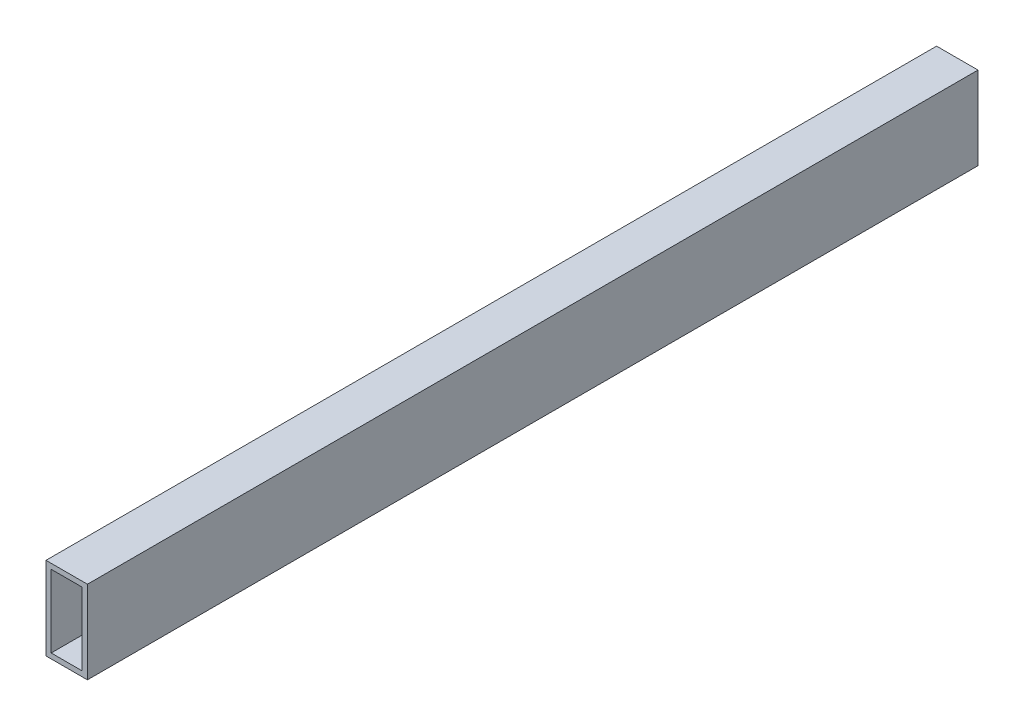
from build123d import *

# Parameters (mm, degrees)
SKETCH1_W           = 25.4
SKETCH1_H           = 50.8
SKETCH1_W_2         = 19.05
SKETCH1_H_2         = 44.45
BOSS_EXTRUDE1_DEPTH = 546.1


with BuildPart() as part:
    # Sketch1 → Boss-Extrude1 (new body)
    with BuildSketch(Plane.XY):
        Rectangle(SKETCH1_W, SKETCH1_H)
        Rectangle(SKETCH1_W_2, SKETCH1_H_2, mode=Mode.SUBTRACT)
    extrude(amount=BOSS_EXTRUDE1_DEPTH)


solid = part.part
